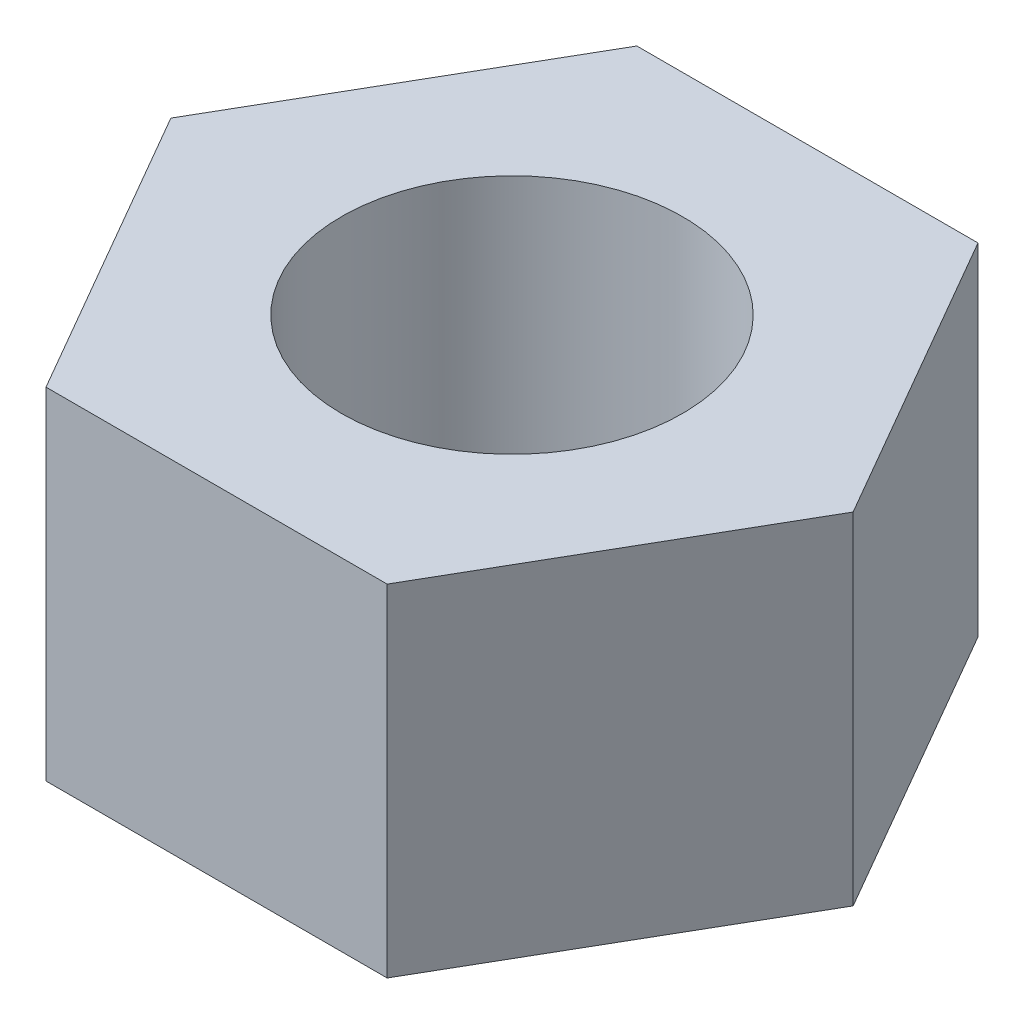
from build123d import *

# Parameters (mm, degrees)
BOSS_EXTRUDE1_DEPTH = 12
SKETCH2_R           = 6
CUT_EXTRUDE1_DEPTH  = 12


with BuildPart() as part:
    # Sketch1 → Boss-Extrude1 (new body)
    with BuildSketch(Plane(origin=(0, 0, 0), x_dir=(1, 0, 0), z_dir=(0, 1, 0))):
        Polygon((6, -10.392304845), (12, 0), (6, 10.392304845), (-6, 10.392304845), (-12, 0), (-6, -10.392304845), align=None)
    extrude(amount=BOSS_EXTRUDE1_DEPTH)

    # Sketch2 → Cut-Extrude1 (cut)
    with BuildSketch(Plane(origin=(0, 12, 0), x_dir=(1, 0, 0), z_dir=(0, 1, 0))):
        with Locations(Location((0, 0, 0), (0, 0, 270))):
            Circle(SKETCH2_R)
    extrude(amount=-CUT_EXTRUDE1_DEPTH, mode=Mode.SUBTRACT)


solid = part.part
